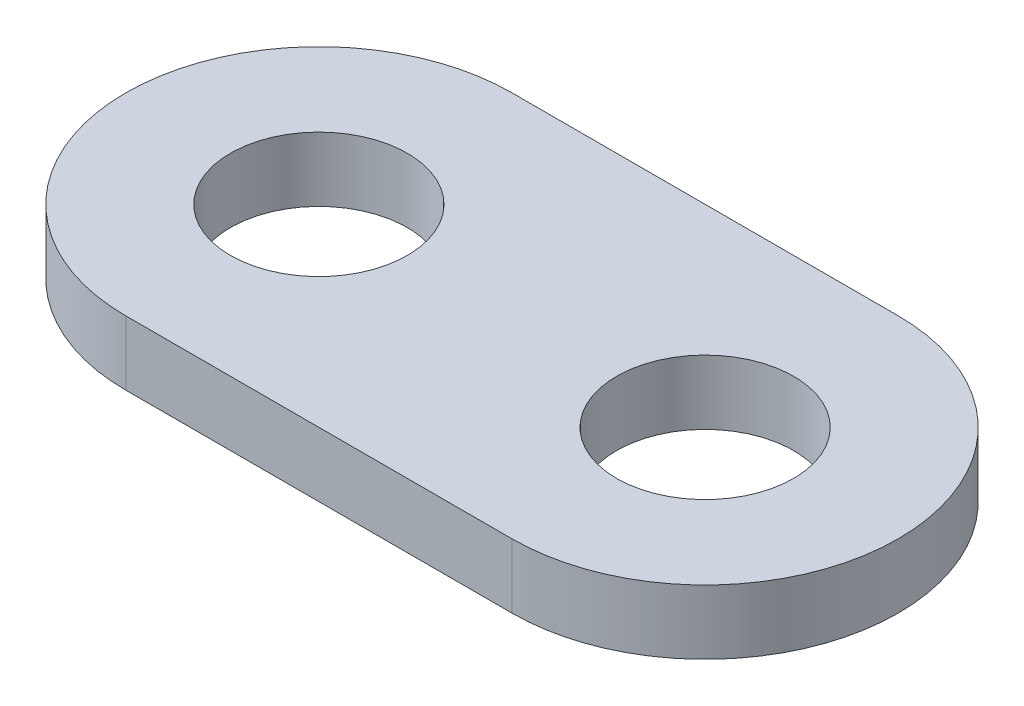
from build123d import *

# Parameters (mm, degrees)
SKETCH1_R           = 2.75
BOSS_EXTRUDE1_DEPTH = 2


with BuildPart() as part:
    # Sketch1 → Boss-Extrude1 (new body)
    with BuildSketch(Plane(origin=(0, 0, 0), x_dir=(1, 0, 0), z_dir=(0, 1, 0))):
        with BuildLine():
            Line((6, 6), (-6, 6))
            ThreePointArc((-6, 6), (-12, 0), (-6, -6))
            Line((-6, -6), (6, -6))
            ThreePointArc((6, -6), (12, 0), (6, 6))
        make_face()
        with Locations(Location((-6, 0, 0), (0, 0, 270))):
            Circle(SKETCH1_R, mode=Mode.SUBTRACT)
        with Locations(Location((6, 0, 0), (0, 0, 270))):
            Circle(SKETCH1_R, mode=Mode.SUBTRACT)
    extrude(amount=BOSS_EXTRUDE1_DEPTH)


solid = part.part
